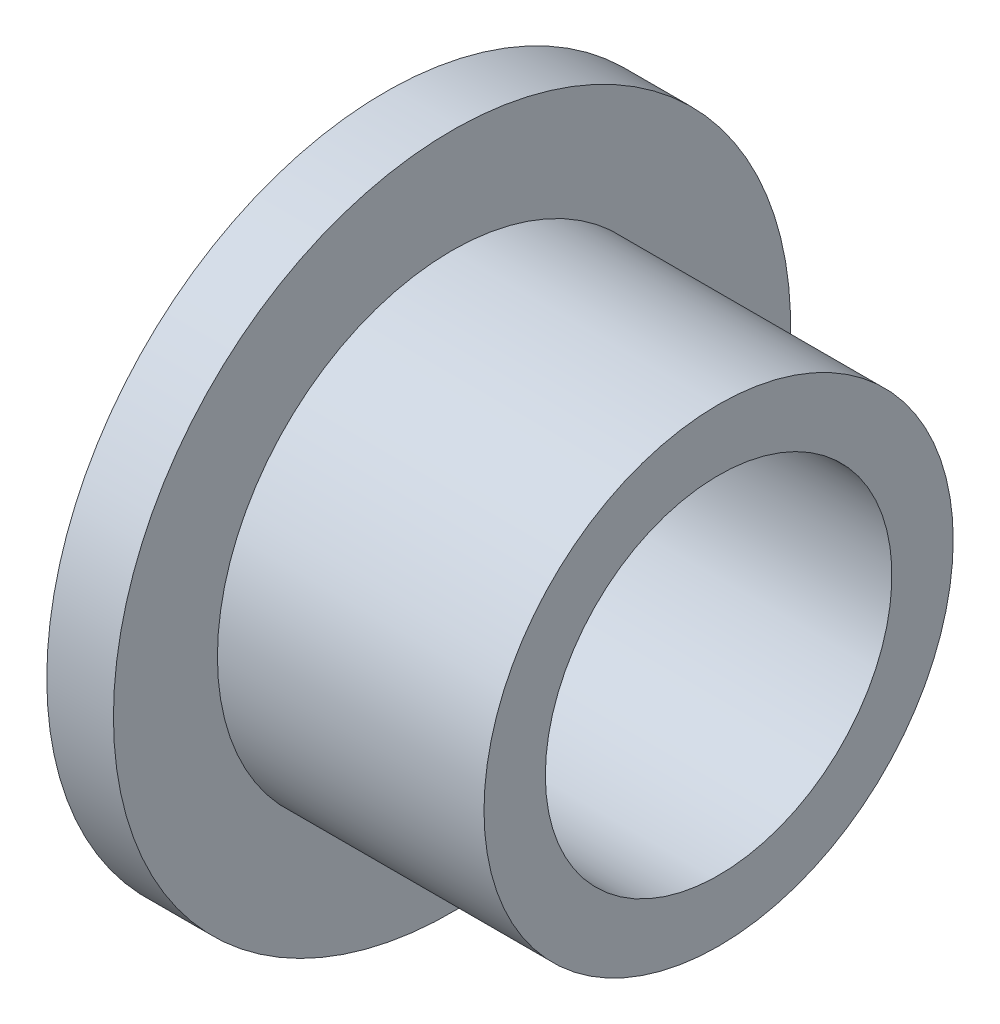
from build123d import *

# Parameters (mm, degrees)
SCALE1_SCALE = 0.484261501


with BuildPart() as part:
    # Sketch1 → Revolve1 (revolve)
    with BuildSketch(Plane(origin=(0, 0, 0), x_dir=(-1, 0, 0), z_dir=(0, 0, -1)), mode=Mode.PRIVATE) as revolve1_sk:
        Polygon((0, 5.588), (0, 4.1275), (7.9375, 4.1275), (7.9375, 8.0645), (6.35, 8.0645), (6.35, 5.588), align=None)
    revolve(revolve1_sk.sketch.rotate(Axis((0, 0, 0), (-1, 0, 0)), 270), axis=Axis((0, 0, 0), (-1, 0, 0)))


with BuildPart() as part_1:
    # Scale1: scaled about (-4.993475751, 0, 0)
    add(part.part.scale(SCALE1_SCALE).moved(Location((-2.575327688, 0, 0))))


solid = part_1.part
